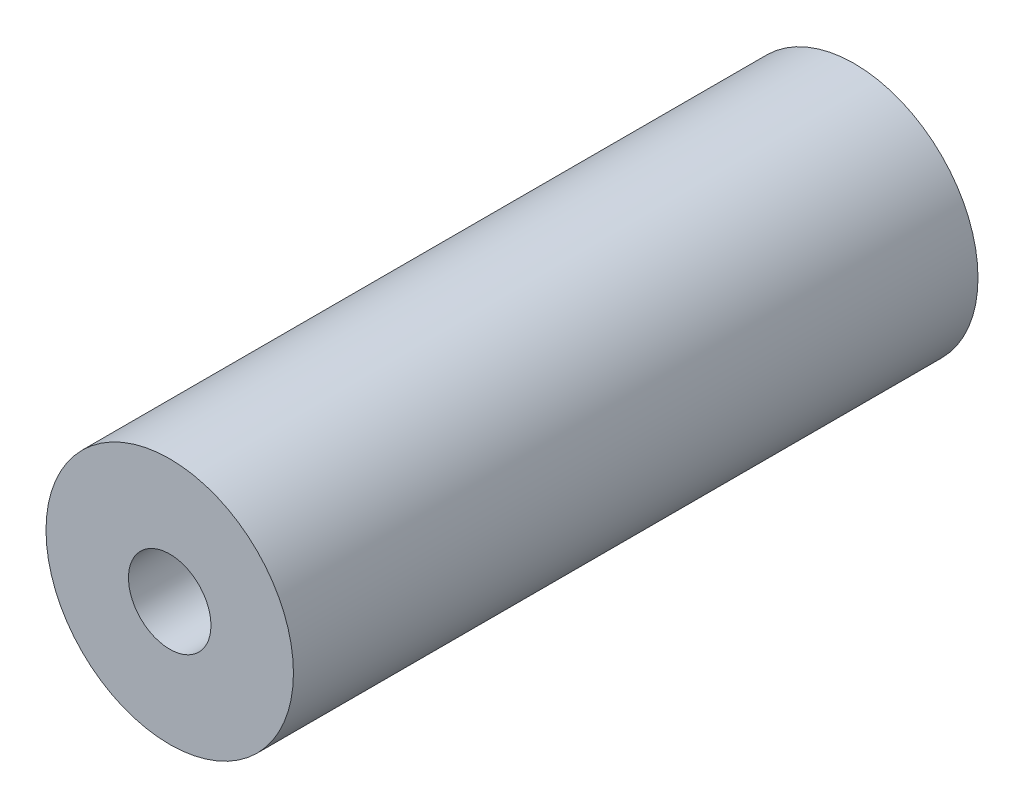
from build123d import *

# Parameters (mm, degrees)
SKETCH_1_R      = 7.5
SKETCH_1_R_2    = 2.5
EXTRUDE_1_DEPTH = 41.5


with BuildPart() as part:
    # 草图1 → 凸台-拉伸1 (new body)
    with BuildSketch(Plane.XY):
        Circle(SKETCH_1_R)
        Circle(SKETCH_1_R_2, mode=Mode.SUBTRACT)
    extrude(amount=EXTRUDE_1_DEPTH)


solid = part.part
